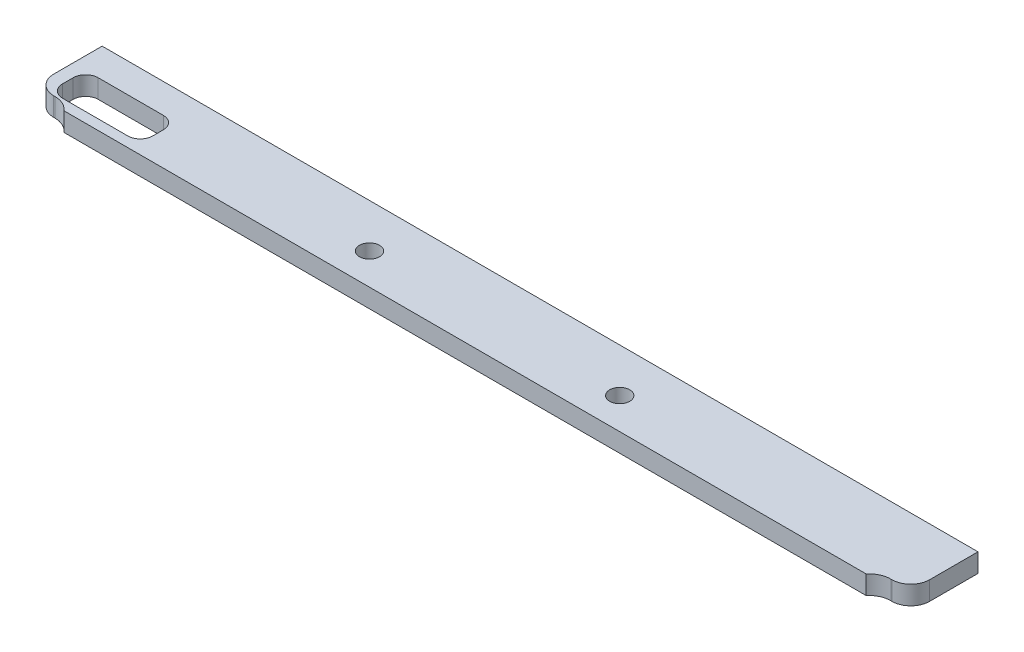
from build123d import *

# Parameters (mm, degrees)
BOSS_EXTRUDE1_DEPTH = 3
CUT_EXTRUDE1_REACH  = 138.82
CUT_EXTRUDE2_DEPTH  = 1
CUT_EXTRUDE3_DEPTH  = 3


with BuildPart() as part:
    # Sketch3 → Boss-Extrude1 (new body)
    with BuildSketch(Plane(origin=(0, 0, 0), x_dir=(1, 0, 0), z_dir=(0, 1, 0))):
        with BuildLine():
            Line((131.37466785, -33.834747513), (131.37466785, -26.093767651))
            Line((131.37466785, -26.093767651), (-8.62533215, -26.093767651))
            Line((-8.62533215, -26.093767651), (-8.62533215, -33.834747513))
            ThreePointArc((-8.62533215, -33.834747513), (-7.746652493, -35.956067857), (-5.62533215, -36.834747513))
            Line((-5.62533215, -36.834747513), (-5.431022837, -36.834747513))
            ThreePointArc((-5.431022837, -36.834747513), (-3.945556452, -37.165616778), (-2.74094445, -38.095667731))
            Line((-2.74094445, -38.095667731), (125.49028015, -38.095667731))
            ThreePointArc((125.49028015, -38.095667731), (126.694892152, -37.165616778), (128.180358538, -36.834747513))
            Line((128.180358538, -36.834747513), (128.37466785, -36.834747513))
            ThreePointArc((128.37466785, -36.834747513), (130.495988194, -35.956067857), (131.37466785, -33.834747513))
        make_face()
    extrude(amount=BOSS_EXTRUDE1_DEPTH)

    # Sketch4 → Cut-Extrude1 (cut, up to next)
    with BuildSketch(Plane(origin=(0, 3, 0), x_dir=(1, 0, 0), z_dir=(0, 1, 0)), mode=Mode.PRIVATE) as cut_extrude1_sk1:
        with BuildLine():
            ThreePointArc((81.109797099, -31.496885933), (79.509797099, -33.096885933), (81.109797099, -34.696885933))
            ThreePointArc((81.109797099, -34.696885933), (82.709797099, -33.096885933), (81.109797099, -31.496885933))
        make_face()
    cut_extrude1_tool1 = extrude(cut_extrude1_sk1.sketch, amount=-CUT_EXTRUDE1_REACH, mode=Mode.PRIVATE) & part.part
    # Sketch4 → Cut-Extrude1 (cut, up to next)
    with BuildSketch(Plane(origin=(0, 3, 0), x_dir=(1, 0, 0), z_dir=(0, 1, 0)), mode=Mode.PRIVATE) as cut_extrude1_sk2:
        with BuildLine():
            ThreePointArc((41.109797099, -31.496885933), (39.509797099, -33.096885933), (41.109797099, -34.696885933))
            ThreePointArc((41.109797099, -34.696885933), (42.709797099, -33.096885933), (41.109797099, -31.496885933))
        make_face()
    cut_extrude1_tool2 = extrude(cut_extrude1_sk2.sketch, amount=-CUT_EXTRUDE1_REACH, mode=Mode.PRIVATE) & part.part
    add(cut_extrude1_tool1.solids().sort_by_distance((81.109797, 3, 33.096886))[0], mode=Mode.SUBTRACT)
    add(cut_extrude1_tool2.solids().sort_by_distance((41.109797, 3, 33.096886))[0], mode=Mode.SUBTRACT)

    # Sketch5 → Cut-Extrude2 (cut)
    with BuildSketch(Plane.XZ):
        with BuildLine():
            Line((12.809243061, 32.25429666), (12.495140497, 32.25429666))
            add(Edge.make_bspline(
                [(12.495140497, 32.25429666), (12.49718765, 32.295967547), (12.501208204, 32.377808062), (12.520036494, 32.497131968), (12.546977371, 32.611186767), (12.585068825, 32.719056681), (12.632375103, 32.821695488), (12.68910513, 32.918695504), (12.75629898, 33.009686693), (12.832505715, 33.093825536), (12.915274354, 33.171013107), (13.004580293, 33.23766835), (13.09842532, 33.293986021), (13.196524719, 33.341067263), (13.299985283, 33.376407109), (13.407868141, 33.402628748), (13.520647277, 33.418405094), (13.597487299, 33.42010088), (13.636566779, 33.420963326)],
                knots=[0, 0, 0, 0, 1.10065271, 2.161652631, 3.183658789, 4.190468796, 5.17591951, 6.163126047, 7.15150782, 8.156236427, 9.156009102, 10.134482811, 11.092018607, 12.041330605, 13.001268258, 13.972401359, 14.968799086, 16, 16, 16, 16], degree=3))
            add(Edge.make_bspline(
                [(13.636566779, 33.420963326), (13.674944853, 33.42006487), (13.750356398, 33.418299435), (13.860418413, 33.403138406), (13.965195707, 33.379392814), (14.064483474, 33.346077398), (14.157489538, 33.30129297), (14.244912583, 33.247495432), (14.327793393, 33.1852756), (14.402400177, 33.112021787), (14.470908256, 33.033819402), (14.530010511, 32.950331499), (14.580623675, 32.864102213), (14.622811355, 32.774474012), (14.653867494, 32.680602983), (14.677445702, 32.58385578), (14.690773115, 32.483230969), (14.692818539, 32.415124414), (14.693858446, 32.380498583)],
                knots=[0, 0, 0, 0, 1.111607364, 2.184268762, 3.212621178, 4.221274766, 5.211760367, 6.196651075, 7.1921475, 8.207485113, 9.220403448, 10.201281604, 11.166441695, 12.114753415, 13.065576456, 14.026450734, 14.996634279, 16, 16, 16, 16], degree=3))
            add(Edge.make_bspline(
                [(14.693858446, 32.380498583), (14.692171801, 32.331748773), (14.688828109, 32.235104645), (14.659972407, 32.092900288), (14.61539031, 31.954995228), (14.561317281, 31.844016176), (14.506696713, 31.755039283), (14.458516917, 31.681123642), (14.400864565, 31.602297225), (14.334267151, 31.517766116), (14.259729345, 31.427271746), (14.176714677, 31.33077698), (14.084588987, 31.229306675), (14.019930805, 31.160000862), (13.986426555, 31.124088326)],
                knots=[0, 0, 0, 0, 1.184203166, 2.347625244, 3.513805382, 4.700623107, 5.337941753, 6.051866363, 6.845199593, 7.711357327, 8.668078039, 9.695487809, 10.805859518, 12, 12, 12, 12], degree=3))
            Line((13.986426555, 31.124088326), (13.110725433, 30.190194095))
            Line((13.110725433, 30.190194095), (14.738730241, 30.190194095))
            Line((14.738730241, 30.190194095), (14.738730241, 29.831219737))
            Line((14.738730241, 29.831219737), (12.360525113, 29.831219737))
            Line((12.360525113, 29.831219737), (13.717896908, 31.279737365))
            add(Edge.make_bspline(
                [(13.717896908, 31.279737365), (13.750944794, 31.314235671), (13.814423021, 31.380499858), (13.904205598, 31.477242818), (13.984844587, 31.566992359), (14.056861979, 31.649578907), (14.118695485, 31.726210475), (14.173567717, 31.794405179), (14.217533308, 31.857159629), (14.265248703, 31.929900243), (14.311462685, 32.01871256), (14.351175041, 32.127246249), (14.375389889, 32.238973502), (14.378294725, 32.314475539), (14.379755882, 32.352453711)],
                knots=[0, 0, 0, 0, 1.329631726, 2.553950428, 3.673215718, 4.687767853, 5.603093632, 6.413772471, 7.123043292, 7.734684054, 8.834405432, 9.900288307, 10.943827018, 12, 12, 12, 12], degree=3))
            add(Edge.make_bspline(
                [(14.379755882, 32.352453711), (14.37912014, 32.376335109), (14.377867214, 32.42340076), (14.366809516, 32.492406519), (14.35009901, 32.558971332), (14.326153752, 32.623299952), (14.294547012, 32.684745604), (14.256073632, 32.743383084), (14.211683569, 32.800072049), (14.160332299, 32.853225347), (14.103920779, 32.901906553), (14.04432653, 32.945030638), (13.981276426, 32.981069749), (13.915036303, 33.010613246), (13.845790834, 33.033788627), (13.773406089, 33.049847207), (13.698082073, 33.059929691), (13.646648577, 33.061293862), (13.620440978, 33.061988967)],
                knots=[0, 0, 0, 0, 0.991446411, 1.95395049, 2.89581595, 3.838931463, 4.798493298, 5.75982156, 6.748411868, 7.785213223, 8.824556874, 9.840280684, 10.836137867, 11.835679398, 12.848801643, 13.863922112, 14.911575587, 16, 16, 16, 16], degree=3))
            add(Edge.make_bspline(
                [(13.620440978, 33.061988967), (13.593070145, 33.061273935), (13.539318349, 33.05986973), (13.460399316, 33.050047066), (13.385113539, 33.033101225), (13.313271636, 33.009924551), (13.24475205, 32.980466002), (13.179888006, 32.943774257), (13.118825117, 32.899990764), (13.061448593, 32.850350208), (13.008584614, 32.795082607), (12.962137738, 32.733472644), (12.921553724, 32.666645228), (12.886144491, 32.594780678), (12.857388801, 32.517226898), (12.83541565, 32.434259193), (12.818028803, 32.346237811), (12.812220283, 32.285452727), (12.809243061, 32.25429666)],
                knots=[0, 0, 0, 0, 1.031018746, 2.02475058, 2.990194455, 3.934040569, 4.864654155, 5.795059489, 6.735614925, 7.690564532, 8.649604399, 9.611025574, 10.590972636, 11.591080095, 12.624614302, 13.701020113, 14.821632451, 16, 16, 16, 16], degree=3))
        make_face()
    extrude(amount=-CUT_EXTRUDE2_DEPTH, mode=Mode.SUBTRACT)

    # Sketch6 → Cut-Extrude3 (cut)
    with BuildSketch(Plane(origin=(0, 3, 0), x_dir=(1, 0, 0), z_dir=(0, 1, 0))):
        with BuildLine():
            Line((5.852113338, -30.785571201), (-4.565790678, -30.785571201))
            ThreePointArc((-4.565790678, -30.785571201), (-5.98000424, -31.371357639), (-6.565790678, -32.785571201))
            Line((-6.565790678, -32.785571201), (-6.565790678, -34.477380503))
            ThreePointArc((-6.565790678, -34.477380503), (-5.98000424, -35.891594066), (-4.565790678, -36.477380503))
            Line((-4.565790678, -36.477380503), (5.852113338, -36.477380503))
            ThreePointArc((5.852113338, -36.477380503), (7.266326901, -35.891594066), (7.852113338, -34.477380503))
            Line((7.852113338, -34.477380503), (7.852113338, -32.785571201))
            ThreePointArc((7.852113338, -32.785571201), (7.266326901, -31.371357639), (5.852113338, -30.785571201))
        make_face()
    extrude(amount=-CUT_EXTRUDE3_DEPTH, mode=Mode.SUBTRACT)


solid = part.part
